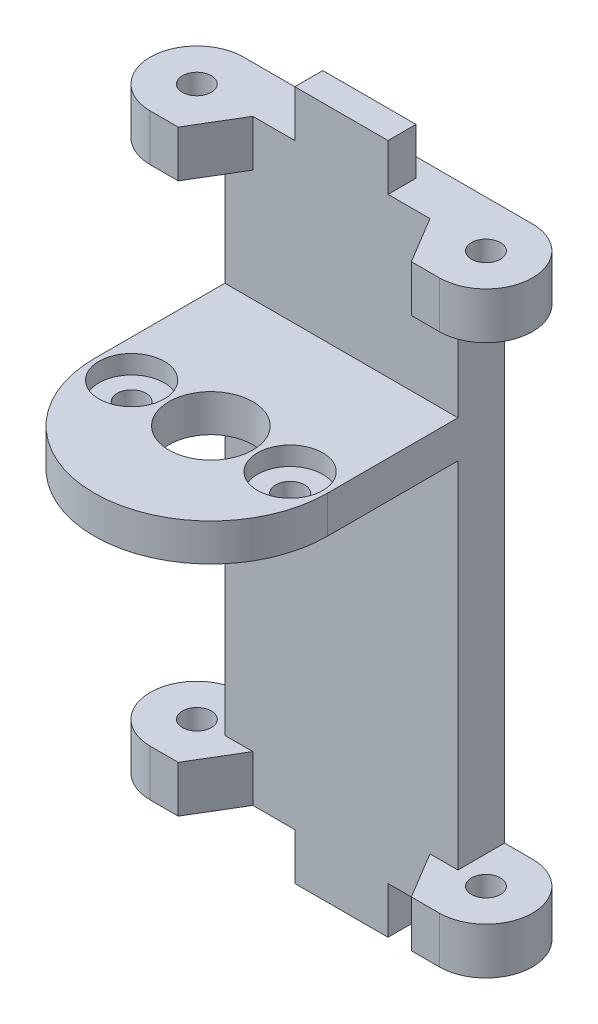
from build123d import *

# Parameters (mm, degrees)
SKETCH11_R          = 1.55
SKETCH11_R_2        = 4.5
BOSS_EXTRUDE1_DEPTH = 4
BOSS_EXTRUDE2_DEPTH = 5
SKETCH13_R          = 3.5
CUT_EXTRUDE1_DEPTH  = 2
SKETCH14_R          = 1.55
BOSS_EXTRUDE3_DEPTH = 5
BOSS_EXTRUDE4_START = -5
SKETCH15_R          = 1.55
BOSS_EXTRUDE4_DEPTH = 5
SKETCH16_W          = 10
SKETCH16_H          = 3
BOSS_EXTRUDE5_DEPTH = 5
SKETCH17_W          = 10
SKETCH17_H          = 3
BOSS_EXTRUDE6_DEPTH = 5


with BuildPart() as part:
    # Sketch11 → Boss-Extrude1 (new body)
    with BuildSketch(Plane(origin=(0, 0, 51.65), x_dir=(1, 0, 0), z_dir=(0, -1, 0))):
        with BuildLine():
            Line((12.5, 85.5), (12.5, 71.5))
            Line((12.5, 71.5), (-12.5, 71.5))
            Line((-12.5, 71.5), (-12.5, 85.5))
            ThreePointArc((-12.5, 85.5), (0, 98), (12.5, 85.5))
        make_face()
        with Locations(Location((-8.5, 85.5, 0), (0, 0, 270))):
            Circle(SKETCH11_R, mode=Mode.SUBTRACT)
        with Locations(Location((8.5, 85.5, 0), (0, 0, 270))):
            Circle(SKETCH11_R, mode=Mode.SUBTRACT)
        with Locations(Location((0, 85.5, 0), (0, 0, 270))):
            Circle(SKETCH11_R_2, mode=Mode.SUBTRACT)
    extrude(amount=BOSS_EXTRUDE1_DEPTH)

    # Sketch12 → Boss-Extrude2 (add)
    with BuildSketch(Plane(origin=(0, 0, 123.15), x_dir=(-1, 0, 0), z_dir=(0, 0, -1))):
        Polygon((-12.5, 0), (-12.5, 17), (12.5, 17), (12.5, 0), (12.5, -4), (12.5, -47), (-12.5, -47), (-12.5, -4), align=None)
    extrude(amount=BOSS_EXTRUDE2_DEPTH)

    # Sketch13 → Cut-Extrude1 (cut)
    with BuildSketch(Plane(origin=(0, 0, 0), x_dir=(1, 0, 0), z_dir=(0, 1, 0))):
        with Locations(Location((-8.5, -137.15, 0), (0, 0, 270))):
            Circle(SKETCH13_R)
        with Locations(Location((8.5, -137.15, 0), (0, 0, 270))):
            Circle(SKETCH13_R)
    extrude(amount=-CUT_EXTRUDE1_DEPTH, mode=Mode.SUBTRACT)

    # Sketch14 → Boss-Extrude3 (add)
    with BuildSketch(Plane(origin=(0, 17, 0), x_dir=(1, 0, 0), z_dir=(0, 1, 0))):
        with BuildLine():
            Line((15.5, -118.15), (-15.5, -118.15))
            ThreePointArc((-15.5, -118.15), (-20.5, -123.15), (-15.5, -128.15))
            Line((-15.5, -128.15), (-12.5, -128.15))
            Line((-12.5, -128.15), (-9.5, -123.15))
            Line((-9.5, -123.15), (9.5, -123.15))
            Line((9.5, -123.15), (12.5, -128.15))
            Line((12.5, -128.15), (15.5, -128.15))
            ThreePointArc((15.5, -128.15), (20.5, -123.15), (15.5, -118.15))
        make_face()
        with Locations(Location((-15.5, -123.15, 0), (0, 0, 270))):
            Circle(SKETCH14_R, mode=Mode.SUBTRACT)
        with Locations(Location((15.5, -123.15, 0), (0, 0, 270))):
            Circle(SKETCH14_R, mode=Mode.SUBTRACT)
    extrude(amount=-BOSS_EXTRUDE3_DEPTH)

    # Sketch15 → Boss-Extrude4 (add)
    with BuildSketch(Plane(origin=(0, -47, 0), x_dir=(-1, 0, 0), z_dir=(0, -1, 0)).offset(BOSS_EXTRUDE4_START)):
        with BuildLine():
            Line((15.5, -118.15), (-15.5, -118.15))
            ThreePointArc((-15.5, -118.15), (-20.5, -123.15), (-15.5, -128.15))
            Line((-15.5, -128.15), (-12.5, -128.15))
            Line((-12.5, -128.15), (-9.5, -123.15))
            Line((-9.5, -123.15), (9.5, -123.15))
            Line((9.5, -123.15), (12.5, -128.15))
            Line((12.5, -128.15), (15.5, -128.15))
            ThreePointArc((15.5, -128.15), (20.5, -123.15), (15.5, -118.15))
        make_face()
        with Locations(Location((15.5, -123.15, 0), (0, 0, 270))):
            Circle(SKETCH15_R, mode=Mode.SUBTRACT)
        with Locations(Location((-15.5, -123.15, 0), (0, 0, 270))):
            Circle(SKETCH15_R, mode=Mode.SUBTRACT)
    extrude(amount=BOSS_EXTRUDE4_DEPTH)

    # Sketch16 → Boss-Extrude5 (add)
    with BuildSketch(Plane.XZ.offset(47)):
        with Locations((0, 121.65)):
            Rectangle(SKETCH16_W, SKETCH16_H)
    extrude(amount=BOSS_EXTRUDE5_DEPTH)

    # Sketch17 → Boss-Extrude6 (add)
    with BuildSketch(Plane(origin=(0, 17, 0), x_dir=(1, 0, 0), z_dir=(0, 1, 0))):
        with Locations((0, -121.65)):
            Rectangle(SKETCH17_W, SKETCH17_H)
    extrude(amount=BOSS_EXTRUDE6_DEPTH)


solid = part.part
